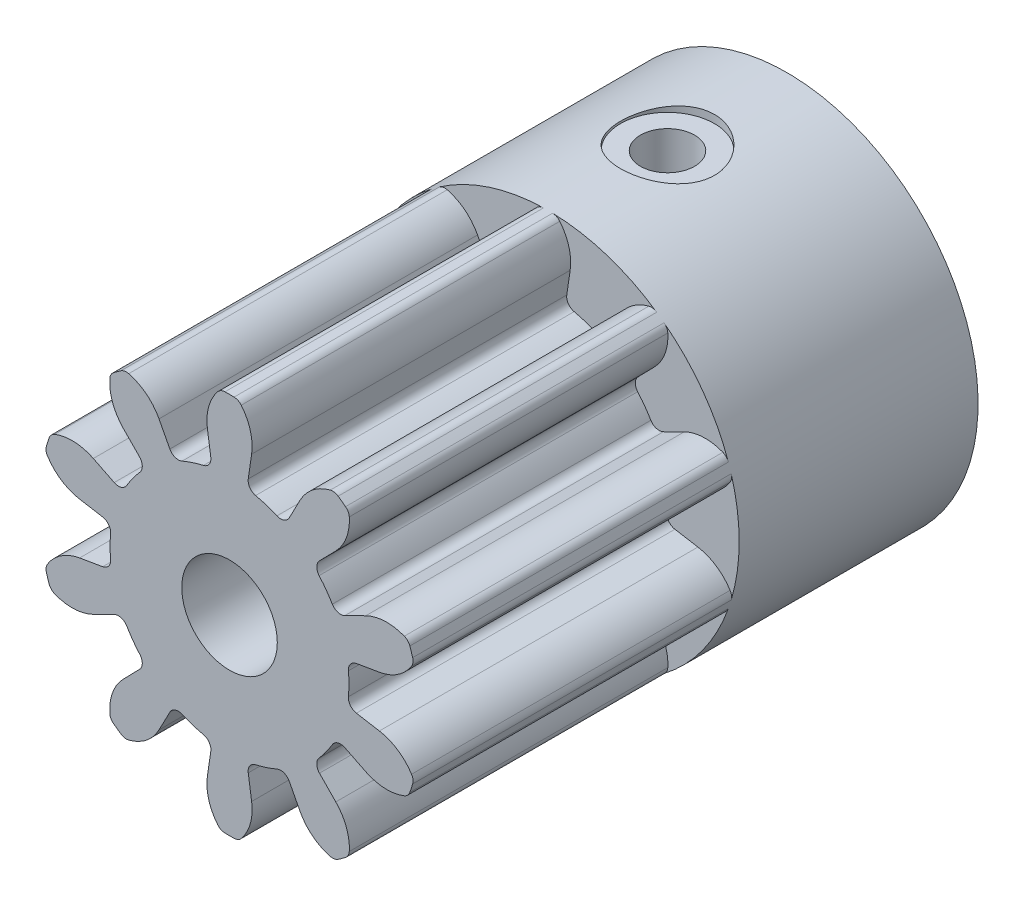
from build123d import *

# Parameters (mm, degrees)
EXTRUDE_ARCO_DEPTH      = 10
EXTRUDE_ARCO_DEPTH_BACK = 10
ARCO_R                  = 7.5
ARCO_R_2                = 3
EXTRUDE_DIENTE_DEPTH    = 10
CIRPATTERN2_COUNT       = 10
SKETCH1_R               = 12
SKETCH1_R_2             = 3
BOSS_EXTRUDE1_DEPTH     = 15
CUT_EXTRUDE1_DEPTH      = 1.5
CUT_EXTRUDE1_DEPTH_BACK = 1.5
CUT_EXTRUDE2_DEPTH      = 10
CUT_EXTRUDE2_DEPTH_BACK = 6.5
SKETCH4_R               = 1.7
SKETCH5_R               = 2.95
CUT_EXTRUDE3_DEPTH      = 0.5


with BuildPart() as part:
    # Arco → Extrude-Arco (new, two sides: drawn at the far end of the back side and taken through both)
    with BuildSketch(Plane.XY.offset(-EXTRUDE_ARCO_DEPTH_BACK)):
        Circle(ARCO_R)
        Circle(ARCO_R_2, mode=Mode.SUBTRACT)
    extrude(amount=EXTRUDE_ARCO_DEPTH + EXTRUDE_ARCO_DEPTH_BACK)

    # Diente → Extrude-Diente (add, symmetric)
    with BuildSketch(Plane.XY):
        with BuildLine():
            Line((-1.175085463, 7.991819202), (-1.388420254, 9.442720542))
            ThreePointArc((-1.388420254, 9.442720542), (-1.310000279, 10.680288159), (-0.735365037, 11.779159234))
            ThreePointArc((-0.735365037, 11.779159234), (-0.535002059, 11.936520541), (-0.287406745, 11.99655773))
            ThreePointArc((-0.287406745, 11.99655773), (0, 12), (0.287406745, 11.99655773))
            ThreePointArc((0.287406745, 11.99655773), (0.535002059, 11.936520541), (0.735365037, 11.779159234))
            ThreePointArc((0.735365037, 11.779159234), (1.310000279, 10.680288159), (1.388420254, 9.442720542))
            Line((1.388420254, 9.442720542), (1.175085463, 7.991819202))
            ThreePointArc((1.175085463, 7.991819202), (1.274294688, 7.564594096), (1.637687862, 7.319014856))
            ThreePointArc((1.637687862, 7.319014856), (0, 7.5), (-1.637687862, 7.319014856))
            ThreePointArc((-1.637687862, 7.319014856), (-1.274294688, 7.564594096), (-1.175085463, 7.991819202))
        make_face()
    extrude_diente = extrude(amount=EXTRUDE_DIENTE_DEPTH, both=True)

    # CirPattern2: Extrude-Diente ×10 about axis
    cirpattern2_axis = Axis((0, 0, 10), (0, 0, 1))
    for i in range(1, CIRPATTERN2_COUNT):
        add(extrude_diente.rotate(cirpattern2_axis, i * 360 / CIRPATTERN2_COUNT))

    # Sketch1 → Boss-Extrude1 (add)
    with BuildSketch(Plane(origin=(0, 0, -10), x_dir=(-1, 0, 0), z_dir=(0, 0, -1))):
        Circle(SKETCH1_R)
        Circle(SKETCH1_R_2, mode=Mode.SUBTRACT)
    extrude(amount=BOSS_EXTRUDE1_DEPTH)

    # Sketch3 → Cut-Extrude1 (cut, two sides: drawn at the far end of the back side and taken through both)
    with BuildSketch(Plane(origin=(0, 7.4, 0), x_dir=(1, 0, 0), z_dir=(0, 1, 0)).offset(-CUT_EXTRUDE1_DEPTH_BACK)):
        Polygon((1.675, 14.598814897), (3.35, 17.5), (3.35, 26.506094844), (-3.35, 26.506094844), (-3.35, 17.5), (-1.675, 14.598814897), align=None)
    extrude(amount=CUT_EXTRUDE1_DEPTH + CUT_EXTRUDE1_DEPTH_BACK, mode=Mode.SUBTRACT)

    # Sketch4 → Cut-Extrude2 (cut, two sides: drawn at the far end of the back side and taken through both)
    with BuildSketch(Plane(origin=(0, 7.4, 0), x_dir=(1, 0, 0), z_dir=(0, 1, 0)).offset(-CUT_EXTRUDE2_DEPTH_BACK)):
        with Locations((0, 17.5)):
            Circle(SKETCH4_R)
    extrude(amount=CUT_EXTRUDE2_DEPTH + CUT_EXTRUDE2_DEPTH_BACK, mode=Mode.SUBTRACT)

    # Sketch5 → Cut-Extrude3 (cut)
    with BuildSketch(Plane(origin=(0, 12, 0), x_dir=(1, 0, 0), z_dir=(0, 1, 0))):
        with Locations((0, 17.5)):
            Circle(SKETCH5_R)
    extrude(amount=-CUT_EXTRUDE3_DEPTH, mode=Mode.SUBTRACT)


solid = part.part
